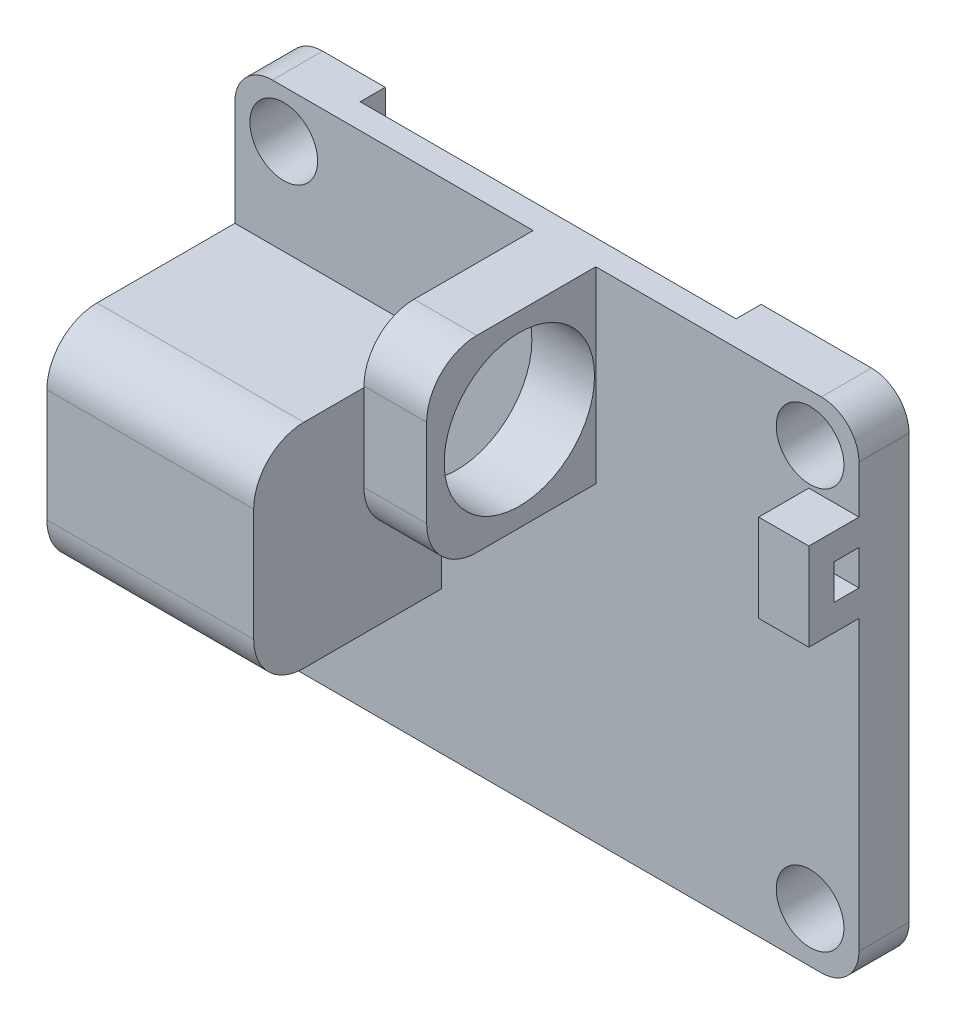
from build123d import *

# Parameters (mm, degrees)
CROQUIS1_W               = 49.8
CROQUIS1_H               = 39.8
CROQUIS1_R               = 2.7
SALIENTE_EXTRUIR1_DEPTH  = 6
CORTAR_EXTRUIR1_DEPTH    = 4
SALIENTE_EXTRUIR3_DEPTH  = 3
CROQUIS5_R               = 6.35
CORTAR_EXTRUIR2_DEPTH    = 3
SALIENTE_EXTRUIR4_DEPTH  = 10
SALIENTE_EXTRUIR5_DEPTH  = 2
CORTAR_EXTRUIR3_START    = -3
CORTAR_EXTRUIR3_DEPTH    = 3
CORTAR_EXTRUIR4_DEPTH    = 4
CROQUIS10_W              = 4
CROQUIS10_H              = 7
SALIENTE_EXTRUIR6_DEPTH  = 4
CORTAR_EXTRUIR5_START    = -4
CORTAR_EXTRUIR5_DEPTH    = 4
CROQUIS16_W              = 28.958796265
CROQUIS16_H              = 47.870649268
CORTAR_EXTRUIR6_DEPTH    = 2
CROQUIS17_W              = 5
CROQUIS17_H              = 16
CORTAR_EXTRUIR7_DEPTH    = 10
CORTAR_EXTRUIR8_DEPTH    = 2
SALIENTE_EXTRUIR7_DEPTH  = 2
CROQUIS22_R              = 6.5
SALIENTE_EXTRUIR9_DEPTH  = 15
SALIENTE_EXTRUIR10_DEPTH = 1.5
CROQUIS25_W              = 5
CROQUIS25_H              = 15
SALIENTE_EXTRUIR11_DEPTH = 13.5
CORTAR_EXTRUIR9_START    = -5
CROQUIS26_R              = 6
CORTAR_EXTRUIR9_DEPTH    = 5
REDONDEO2_R              = 4
CROQUIS27_W              = 8
CROQUIS27_H              = 39.8
CROQUIS27_R              = 2.7
CROQUIS27_W_2            = 11.8
SALIENTE_EXTRUIR13_DEPTH = 2
REDONDEO3_R              = 3


with BuildPart() as part:
    # Croquis1 → Saliente-Extruir1 (new body)
    with BuildSketch(Plane.XY):
        with Locations((-31.963412372, -3.757931034)):
            Rectangle(CROQUIS1_W, CROQUIS1_H)
        with Locations((-52.963412372, 12.342068966)):
            Circle(CROQUIS1_R, mode=Mode.SUBTRACT)
        with Locations((-10.963412372, 12.342068966)):
            Circle(CROQUIS1_R, mode=Mode.SUBTRACT)
        with Locations((-10.963412372, -19.657931034)):
            Circle(CROQUIS1_R, mode=Mode.SUBTRACT)
        with Locations((-52.963412372, -19.657931034)):
            Circle(CROQUIS1_R, mode=Mode.SUBTRACT)
    extrude(amount=SALIENTE_EXTRUIR1_DEPTH)

    # Croquis2 → Cortar-Extruir1 (cut)
    with BuildSketch(Plane.XY.offset(6)):
        with BuildLine():
            Line((-49.963412372, -16.757931034), (-13.963412372, -16.757931034))
            ThreePointArc((-13.963412372, -16.757931034), (-12.54919881, -16.172144597), (-11.963412372, -14.757931034))
            Line((-11.963412372, -14.757931034), (-11.963412372, 7.242068966))
            ThreePointArc((-11.963412372, 7.242068966), (-12.54919881, 8.656282528), (-13.963412372, 9.242068966))
            Line((-13.963412372, 9.242068966), (-49.963412372, 9.242068966))
            ThreePointArc((-49.963412372, 9.242068966), (-51.377625934, 8.656282528), (-51.963412372, 7.242068966))
            Line((-51.963412372, 7.242068966), (-51.963412372, -14.757931034))
            ThreePointArc((-51.963412372, -14.757931034), (-51.377625934, -16.172144597), (-49.963412372, -16.757931034))
        make_face()
    extrude(amount=-CORTAR_EXTRUIR1_DEPTH, mode=Mode.SUBTRACT)

    # Croquis4 → Saliente-Extruir3 (add)
    with BuildSketch(Plane(origin=(0, 0, 0), x_dir=(-1, 0, 0), z_dir=(0, 0, -1))):
        with BuildLine():
            Line((56.863412372, 4.242068966), (61.863412372, 4.242068966))
            Line((61.863412372, 4.242068966), (61.863412372, -0.257931034))
            Line((61.863412372, -0.257931034), (57.863412372, -0.257931034))
            ThreePointArc((57.863412372, -0.257931034), (57.358118834, -0.294597605), (56.863412372, -0.403829068))
            Line((56.863412372, -0.403829068), (56.863412372, 4.242068966))
        make_face()
        with BuildLine():
            Line((61.863412372, -11.757931034), (56.863412372, -11.757931034))
            Line((56.863412372, -11.757931034), (56.863412372, -7.112033001))
            ThreePointArc((56.863412372, -7.112033001), (57.358118834, -7.221264464), (57.863412372, -7.257931034))
            Line((57.863412372, -7.257931034), (61.863412372, -7.257931034))
            Line((61.863412372, -7.257931034), (61.863412372, -11.757931034))
        make_face()
    extrude(amount=-SALIENTE_EXTRUIR3_DEPTH)

    # Croquis5 → Cortar-Extruir2 (cut)
    with BuildSketch(Plane.XY.offset(3)):
        with Locations((-57.863412372, -3.757931034)):
            Circle(CROQUIS5_R)
    extrude(amount=CORTAR_EXTRUIR2_DEPTH, mode=Mode.SUBTRACT)

    # Croquis6 → Saliente-Extruir4 (add)
    with BuildSketch(Plane.XY.offset(3)):
        with BuildLine():
            Line((-61.863412372, 4.242068966), (-51.963412372, 4.242068966))
            Line((-51.963412372, 4.242068966), (-48.963412372, 4.242068966))
            Line((-48.963412372, 4.242068966), (-48.963412372, -11.757931034))
            Line((-48.963412372, -11.757931034), (-51.963412372, -11.757931034))
            Line((-51.963412372, -11.757931034), (-61.863412372, -11.757931034))
            Line((-61.863412372, -11.757931034), (-61.863412372, -8.689715701))
            ThreePointArc((-61.863412372, -8.689715701), (-51.513412372, -3.757931034), (-61.863412372, 1.173853632))
            Line((-61.863412372, 1.173853632), (-61.863412372, 4.242068966))
        make_face()
    extrude(amount=SALIENTE_EXTRUIR4_DEPTH)

    # Croquis7 → Saliente-Extruir5 (add)
    with BuildSketch(Plane.XY.offset(2)):
        Polygon((-51.963412372, -3.757931034), (-51.963412372, 4.242068966), (-48.963412372, 4.242068966), (-48.963412372, -11.757931034), (-51.963412372, -11.757931034), align=None)
    extrude(amount=SALIENTE_EXTRUIR5_DEPTH)

    # Croquis8 → Cortar-Extruir3 (cut)
    with BuildSketch(Plane.XY.offset(3).offset(CORTAR_EXTRUIR3_START)):
        with BuildLine():
            Line((-56.863412372, -0.403829068), (-56.863412372, -7.112033001))
            ThreePointArc((-56.863412372, -7.112033001), (-53.509310406, -3.757931034), (-56.863412372, -0.403829068))
        make_face()
    extrude(amount=CORTAR_EXTRUIR3_DEPTH, mode=Mode.SUBTRACT)

    # Croquis9 → Cortar-Extruir4 (cut)
    with BuildSketch(Plane.XY.offset(6)):
        Polygon((-56.863412372, -11.757931034), (-56.863412372, -27.492217147), (-1.817084798, -27.492217147), (-1.817084798, 22.861833321), (-56.863412372, 22.861833321), (-56.863412372, 4.242068966), (-47.172737702, 4.242068966), (-47.172737702, -11.757931034), align=None)
    extrude(amount=-CORTAR_EXTRUIR4_DEPTH, mode=Mode.SUBTRACT)

    # Croquis10 → Saliente-Extruir6 (add)
    with BuildSketch(Plane.XY.offset(2)):
        with Locations((-9.063412372, 5.842068966)):
            Rectangle(CROQUIS10_W, CROQUIS10_H)
    extrude(amount=SALIENTE_EXTRUIR6_DEPTH)

    # Croquis11 → Cortar-Extruir5 (cut)
    with BuildSketch(Plane(origin=(-7.063412372, 0, 0), x_dir=(0, 0, -1), z_dir=(1, 0, 0)).offset(CORTAR_EXTRUIR5_START)):
        Polygon((-2, 5.842068966), (-2, 7.242068966), (-4, 7.242068966), (-4, 4.442068966), (-2, 4.442068966), align=None)
    extrude(amount=CORTAR_EXTRUIR5_DEPTH, mode=Mode.SUBTRACT)

    # Croquis16 → Cortar-Extruir6 (cut)
    with BuildSketch(Plane.XY.offset(2)):
        with Locations((-49.718694927, -6.990346687)):
            Rectangle(CROQUIS16_W, CROQUIS16_H)
    extrude(amount=CORTAR_EXTRUIR6_DEPTH, mode=Mode.SUBTRACT)


with BuildPart() as cortar_extruir6_kept_piece:
    # of the separate pieces the step leaves, the one the design keeps (cortar_extruir6_pieces_kept)
    add(part.part.solids().sort_by_distance((-56.863412372, 16.142068966, 0))[0])

    # Croquis17 → Cortar-Extruir7 (cut)
    with BuildSketch(Plane.XY.offset(2)):
        with Locations((-59.363412372, -3.757931034)):
            Rectangle(CROQUIS17_W, CROQUIS17_H)
    extrude(amount=-CORTAR_EXTRUIR7_DEPTH, mode=Mode.SUBTRACT)

    # Croquis18 → Cortar-Extruir8 (cut)
    with BuildSketch(Plane.XY.offset(2)):
        with BuildLine():
            Line((-56.863412372, -0.403829068), (-50.513412372, -0.403829068))
            ThreePointArc((-50.513412372, -0.403829068), (-47.159310406, -3.757931034), (-50.513412372, -7.112033001))
            Line((-50.513412372, -7.112033001), (-56.863412372, -7.112033001))
            Line((-56.863412372, -7.112033001), (-56.863412372, -0.403829068))
        make_face()
    extrude(amount=-CORTAR_EXTRUIR8_DEPTH, mode=Mode.SUBTRACT)

    # Croquis20 → Saliente-Extruir7 (add)
    with BuildSketch(Plane.XY.offset(2)):
        with BuildLine():
            Line((-56.863412372, -0.403829068), (-56.863412372, -7.112033001))
            Line((-56.863412372, -7.112033001), (-50.513412372, -7.112033001))
            ThreePointArc((-50.513412372, -7.112033001), (-47.159310406, -3.757931034), (-50.513412372, -0.403829068))
            Line((-50.513412372, -0.403829068), (-56.863412372, -0.403829068))
        make_face()
    extrude(amount=-SALIENTE_EXTRUIR7_DEPTH)

    # Croquis22 → Saliente-Extruir9 (add)
    with BuildSketch(Plane.ZY.offset(56.863412372)):
        with BuildLine():
            Line((2, -3.757931034), (2, 4.742068966))
            Line((2, 4.742068966), (13, 4.742068966))
            ThreePointArc((13, 4.742068966), (15.828427125, 3.57049609), (17, 0.742068966))
            Line((17, 0.742068966), (17, -8.257931034))
            ThreePointArc((17, -8.257931034), (15.828427125, -11.086358159), (13, -12.257931034))
            Line((13, -12.257931034), (2, -12.257931034))
            Line((2, -12.257931034), (2, -3.757931034))
        make_face()
        with Locations(Location((8.55, -3.757931034, 0), (0, 0, 270))):
            Circle(CROQUIS22_R, mode=Mode.SUBTRACT)
    extrude(amount=-SALIENTE_EXTRUIR9_DEPTH)

    # Croquis23 → Saliente-Extruir10 (add)
    with BuildSketch(Plane(origin=(-41.863412372, 0, 0), x_dir=(0, 0, -1), z_dir=(1, 0, 0))):
        with BuildLine():
            Line((-13, -12.257931034), (-2, -12.257931034))
            Line((-2, -12.257931034), (-2, 4.742068966))
            Line((-2, 4.742068966), (-13, 4.742068966))
            ThreePointArc((-13, 4.742068966), (-15.828427125, 3.57049609), (-17, 0.742068966))
            Line((-17, 0.742068966), (-17, -8.257931034))
            ThreePointArc((-17, -8.257931034), (-15.828427125, -11.086358159), (-13, -12.257931034))
        make_face()
    extrude(amount=SALIENTE_EXTRUIR10_DEPTH)

    # Croquis25 → Saliente-Extruir11 (add)
    with BuildSketch(Plane.XY.offset(2)):
        with Locations((-30.563412372, 8.642068966)):
            Rectangle(CROQUIS25_W, CROQUIS25_H)
    extrude(amount=SALIENTE_EXTRUIR11_DEPTH)

    # Croquis26 → Cortar-Extruir9 (cut)
    with BuildSketch(Plane(origin=(-28.063412372, 0, 0), x_dir=(0, 0, -1), z_dir=(1, 0, 0)).offset(CORTAR_EXTRUIR9_START)):
        with Locations((-8.1, 8.642068966)):
            Circle(CROQUIS26_R)
    extrude(amount=CORTAR_EXTRUIR9_DEPTH, mode=Mode.SUBTRACT)

    # Redondeo2
    redondeo2_edges = [cortar_extruir6_kept_piece.edges().sort_by_distance(p)[0] for p in [
        (-30.563412372, 1.142068966, 15.5),
        (-30.563412372, 16.142068966, 15.5),
    ]]
    fillet(redondeo2_edges, radius=REDONDEO2_R)

    # Croquis27 → Saliente-Extruir13 (add)
    # profile 1 of 2: a face of its own
    with BuildSketch(Plane(origin=(0, 0, 0), x_dir=(-1, 0, 0), z_dir=(0, 0, -1))):
        with Locations((52.863412372, -3.757931034)):
            Rectangle(CROQUIS27_W, CROQUIS27_H)
        with Locations((52.963412372, -19.657931034)):
            Circle(CROQUIS27_R, mode=Mode.SUBTRACT)
        with Locations((52.963412372, 12.342068966)):
            Circle(CROQUIS27_R, mode=Mode.SUBTRACT)
    # profile 2 of 2: a face of its own
    with BuildSketch(Plane(origin=(0, 0, 0), x_dir=(-1, 0, 0), z_dir=(0, 0, -1))):
        with Locations((12.963412372, -3.757931034)):
            Rectangle(CROQUIS27_W_2, CROQUIS27_H)
        with Locations((10.963412372, 12.342068966)):
            Circle(CROQUIS27_R, mode=Mode.SUBTRACT)
        with Locations((10.963412372, -19.657931034)):
            Circle(CROQUIS27_R, mode=Mode.SUBTRACT)
    extrude(amount=SALIENTE_EXTRUIR13_DEPTH)

    # Redondeo3
    redondeo3_edges = [cortar_extruir6_kept_piece.edges().sort_by_distance(p)[0] for p in [
        (-56.863412372, 16.142068966, 0),
        (-7.063412372, 16.142068966, 0),
        (-7.063412372, -23.657931034, 0),
        (-56.863412372, -23.657931034, 0),
    ]]
    fillet(redondeo3_edges, radius=REDONDEO3_R)


solid = cortar_extruir6_kept_piece.part
